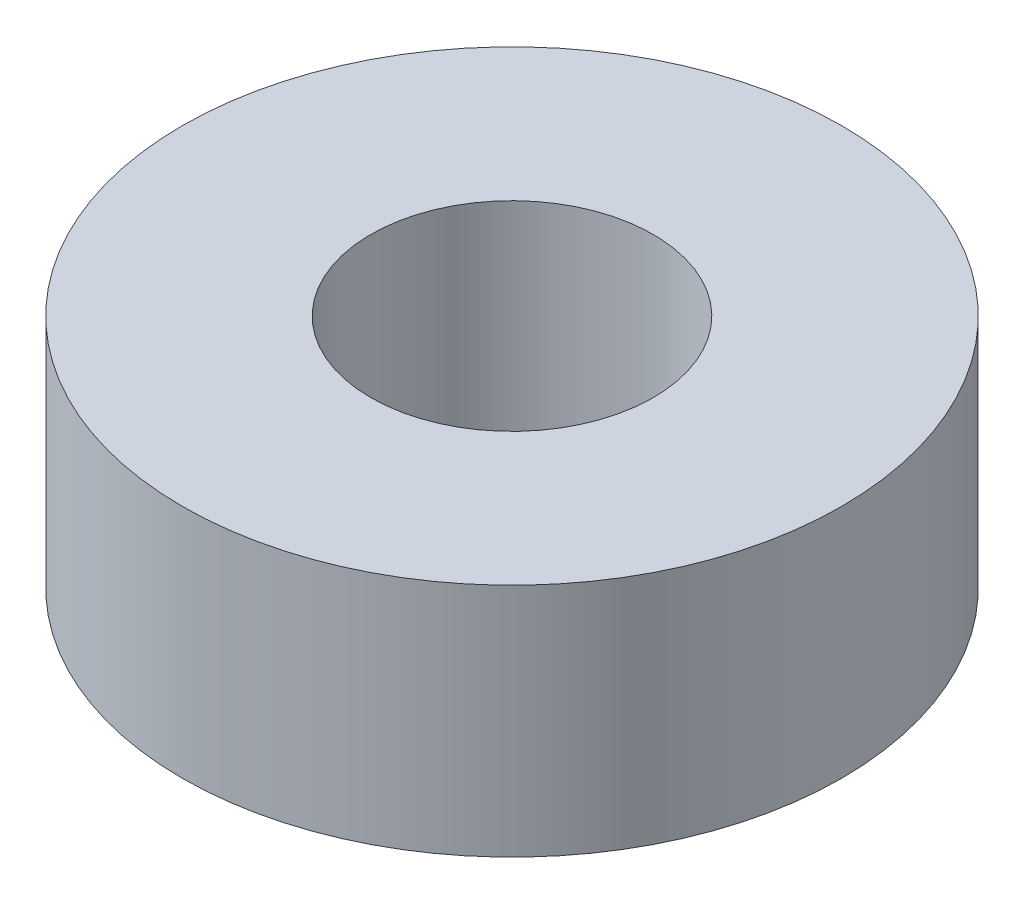
from build123d import *

# Parameters (mm, degrees)
SKETCH2_R           = 7
SKETCH2_R_2         = 3
BOSS_EXTRUDE1_DEPTH = 5


with BuildPart() as part:
    # Sketch2 → Boss-Extrude1 (new body)
    with BuildSketch(Plane(origin=(0, 0, 0), x_dir=(1, 0, 0), z_dir=(0, 1, 0))):
        with Locations(Location((0, 0, 0), (0, 0, 270))):
            Circle(SKETCH2_R)
        with Locations(Location((0, 0, 0), (0, 0, 270))):
            Circle(SKETCH2_R_2, mode=Mode.SUBTRACT)
    extrude(amount=BOSS_EXTRUDE1_DEPTH)


solid = part.part
